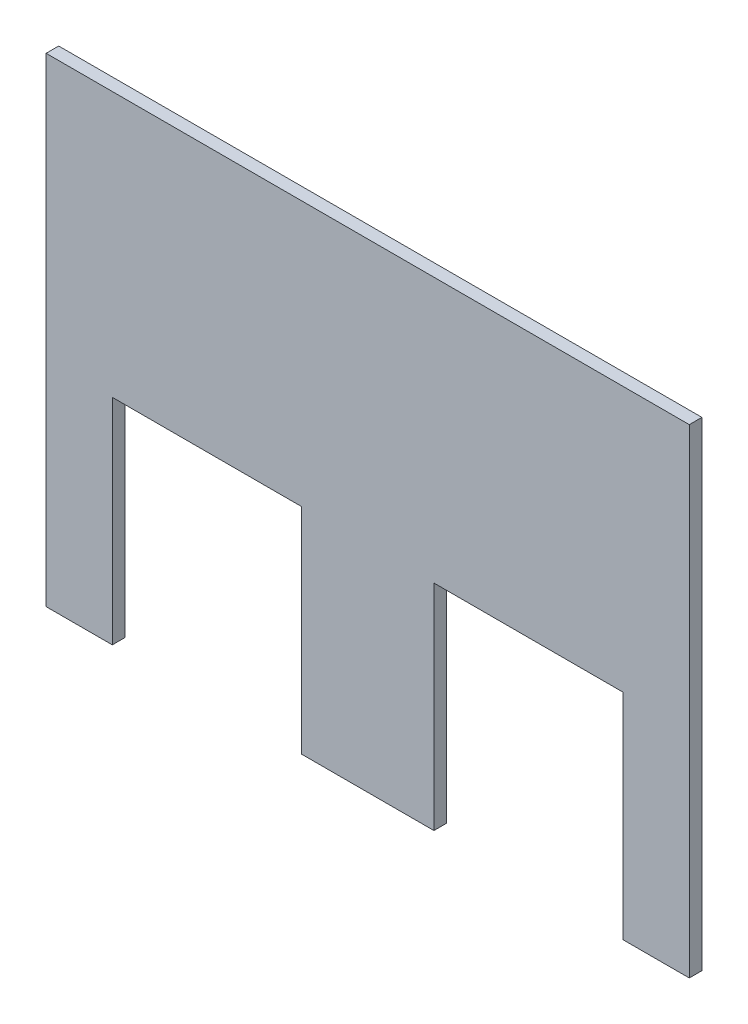
from build123d import *

# Parameters (mm, degrees)
SKETCH1_W           = 510
SKETCH1_H           = 380
BOSS_EXTRUDE1_DEPTH = 10
SKETCH2_W           = 75
SKETCH2_H           = 170
CUT_EXTRUDE1_DEPTH  = 10


with BuildPart() as part:
    # Sketch1 → Boss-Extrude1 (new body)
    with BuildSketch(Plane.XY):
        with Locations((255, 190)):
            Rectangle(SKETCH1_W, SKETCH1_H)
    extrude(amount=BOSS_EXTRUDE1_DEPTH)

    # Sketch2 → Cut-Extrude1 (cut)
    with BuildSketch(Plane.XY.offset(10)):
        with Locations((90, 85)):
            Rectangle(SKETCH2_W, SKETCH2_H)
        with Locations((165, 85)):
            Rectangle(SKETCH2_W, SKETCH2_H)
        with Locations((345, 85)):
            Rectangle(SKETCH2_W, SKETCH2_H)
        with Locations((420, 85)):
            Rectangle(SKETCH2_W, SKETCH2_H)
    extrude(amount=-CUT_EXTRUDE1_DEPTH, mode=Mode.SUBTRACT)


solid = part.part
